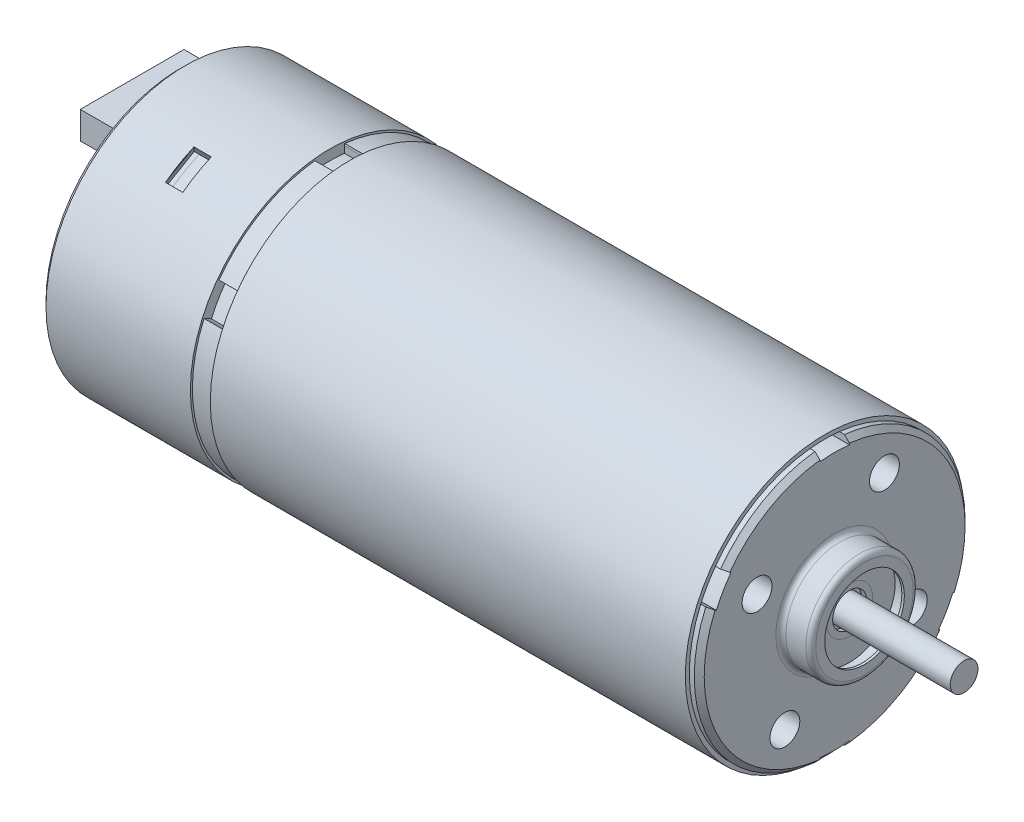
from build123d import *

# Parameters (mm, degrees)
SKETCH1_R               = 13.6
BOSS_EXTRUDE1_DEPTH     = 50.7
CUT_EXTRUDE1_DEPTH      = 55.225547485
SKETCH3_R               = 14
SKETCH3_R_2             = 13.6
BOSS_EXTRUDE2_DEPTH     = 47.7
SKETCH4_R               = 14
BOSS_EXTRUDE3_DEPTH     = 15
BOSS_EXTRUDE4_START     = 2
BOSS_EXTRUDE4_DEPTH     = 2
SKETCH6_R               = 1.5
CUT_EXTRUDE2_DEPTH      = 7
SKETCH7_R               = 5.4
BOSS_EXTRUDE5_DEPTH     = 3
SKETCH8_R               = 4
CUT_EXTRUDE3_DEPTH      = 1.5
SKETCH9_R               = 1.7
CUT_EXTRUDE4_DEPTH      = 0.5
CUT_EXTRUDE5_START      = 1.25
SKETCH12_R              = 4.570841128
SKETCH12_R_2            = 4
CUT_EXTRUDE5_DEPTH      = 1.25
FILLET1_R               = 0.5
CHAMFER1_SIZE           = 0.5
CUT_EXTRUDE6_REACH      = 75.756
CUT_EXTRUDE6_END_RADIUS = 12.956768024
SKETCH13_W              = 1.739955734
SKETCH13_H              = 3.306373614
CUT_EXTRUDE7_DEPTH      = 0.5
CUT_EXTRUDE8_DEPTH      = 3.306373613
BOSS_EXTRUDE7_DEPTH     = 3.306373613
SKETCH17_W              = 10.414574722
SKETCH17_H              = 2.75
BOSS_EXTRUDE8_DEPTH     = 4.85
SKETCH18_W              = 9.614574722
SKETCH18_H              = 1.95
CUT_EXTRUDE10_DEPTH     = 4.85
SKETCH20_R              = 0.7
BOSS_EXTRUDE9_DEPTH     = 4.85
SCALE1_SCALE            = 0.25
SKETCH21_R              = 0.348695204
BOSS_EXTRUDE10_DEPTH    = 3


with BuildPart() as part:
    # Sketch1 → Boss-Extrude1 (new body)
    with BuildSketch(Plane(origin=(0, 0, 0), x_dir=(0, 0, -1), z_dir=(1, 0, 0))):
        Circle(SKETCH1_R)
    extrude(amount=-BOSS_EXTRUDE1_DEPTH)

    # Sketch2 → Cut-Extrude1 (cut, through all)
    with BuildSketch(Plane(origin=(0, 0, 0), x_dir=(0, 0, -1), z_dir=(1, 0, 0))):
        with BuildLine():
            Line((-1.476652596, 12.872347678), (-1.476652596, 14.372812182))
            Line((-1.476652596, 14.372812182), (1.476652596, 14.372812182))
            Line((1.476652596, 14.372812182), (1.476652596, 12.872347678))
            ThreePointArc((1.476652596, 12.872347678), (0, 12.956768024), (-1.476652596, 12.872347678))
        make_face()
        with BuildLine():
            Line((1.476652596, -12.872347678), (1.476652596, -14.372812182))
            Line((1.476652596, -14.372812182), (-1.476652596, -14.372812182))
            Line((-1.476652596, -14.372812182), (-1.476652596, -12.872347678))
            ThreePointArc((-1.476652596, -12.872347678), (0, -12.956768024), (1.476652596, -12.872347678))
        make_face()
        with BuildLine():
            Line((11.886106393, -5.157355179), (13.185546772, -5.907587431))
            Line((13.185546772, -5.907587431), (11.708894176, -8.465224751))
            Line((11.708894176, -8.465224751), (10.409453797, -7.714992499))
            ThreePointArc((10.409453797, -7.714992499), (11.220890259, -6.478384012), (11.886106393, -5.157355179))
        make_face()
        with BuildLine():
            Line((-11.886106393, 5.157355179), (-13.185546772, 5.907587431))
            Line((-13.185546772, 5.907587431), (-11.708894176, 8.465224751))
            Line((-11.708894176, 8.465224751), (-10.409453797, 7.714992499))
            ThreePointArc((-10.409453797, 7.714992499), (-11.220890259, 6.478384012), (-11.886106393, 5.157355179))
        make_face()
    extrude(amount=-CUT_EXTRUDE1_DEPTH, mode=Mode.SUBTRACT)



with BuildPart() as body_2:
    # Sketch3 → Boss-Extrude2 (new body)
    with BuildSketch(Plane(origin=(-1, 0, 0), x_dir=(0, 0, -1), z_dir=(1, 0, 0))):
        Circle(SKETCH3_R)
        Circle(SKETCH3_R_2, mode=Mode.SUBTRACT)
    extrude(amount=-BOSS_EXTRUDE2_DEPTH)


with BuildPart() as body_3:
    # Sketch4 → Boss-Extrude3 (new body)
    with BuildSketch(Plane.ZY.offset(50.7)):
        Circle(SKETCH4_R)
    extrude(amount=BOSS_EXTRUDE3_DEPTH)


with BuildPart() as part_1:
    add(part.part)

    add(body_2.part)  # Boss-Extrude4 merges body 2

    add(body_3.part)  # Boss-Extrude4 merges body 3
    # Sketch5 → Boss-Extrude4 (add)
    with BuildSketch(Plane(origin=(-50.7, 0, 0), x_dir=(0, 0, -1), z_dir=(1, 0, 0)).offset(BOSS_EXTRUDE4_START)):
        with BuildLine():
            Line((1.476652596, 13.519596781), (1.498368075, 13.71841438))
            ThreePointArc((1.498368075, 13.71841438), (11.951150572, 6.9), (12.629679391, -5.561582373))
            Line((12.629679391, -5.561582373), (12.446640559, -5.48097973))
            ThreePointArc((12.446640559, -5.48097973), (11.777945491, 6.8), (1.476652596, 13.519596781))
        make_face()
        with BuildLine():
            Line((-1.476652596, 13.519596781), (-1.498368075, 13.71841438))
            ThreePointArc((-1.498368075, 13.71841438), (-6.9, 11.951150572), (-11.131311316, 8.156832007))
            Line((-11.131311316, 8.156832007), (-10.969987963, 8.038617051))
            ThreePointArc((-10.969987963, 8.038617051), (-6.8, 11.777945491), (-1.476652596, 13.519596781))
        make_face()
        with BuildLine():
            Line((10.969987963, -8.038617051), (11.131311316, -8.156832007))
            ThreePointArc((11.131311316, -8.156832007), (6.9, -11.951150572), (1.498368075, -13.71841438))
            Line((1.498368075, -13.71841438), (1.476652596, -13.519596781))
            ThreePointArc((1.476652596, -13.519596781), (6.8, -11.777945491), (10.969987963, -8.038617051))
        make_face()
        with BuildLine():
            Line((-1.476652596, -13.519596781), (-1.498368075, -13.71841438))
            ThreePointArc((-1.498368075, -13.71841438), (-11.951150572, -6.9), (-12.629679391, 5.561582373))
            Line((-12.629679391, 5.561582373), (-12.446640559, 5.48097973))
            ThreePointArc((-12.446640559, 5.48097973), (-11.777945491, -6.8), (-1.476652596, -13.519596781))
        make_face()
    extrude(amount=-BOSS_EXTRUDE4_DEPTH)

    # Sketch6 → Cut-Extrude2 (cut)
    with BuildSketch(Plane(origin=(0, 0, 0), x_dir=(0, 0, -1), z_dir=(1, 0, 0))):
        with Locations((-5, -8.660254038)):
            Circle(SKETCH6_R)
        with Locations((5, 8.660254038)):
            Circle(SKETCH6_R)
        with Locations((-7.794228634, 4.5)):
            Circle(SKETCH6_R)
        with Locations((7.794228634, -4.5)):
            Circle(SKETCH6_R)
    extrude(amount=-CUT_EXTRUDE2_DEPTH, mode=Mode.SUBTRACT)

    # Sketch7 → Boss-Extrude5 (add)
    with BuildSketch(Plane(origin=(0, 0, 0), x_dir=(0, 0, -1), z_dir=(1, 0, 0))):
        Circle(SKETCH7_R)
    extrude(amount=BOSS_EXTRUDE5_DEPTH)

    # Sketch8 → Cut-Extrude3 (cut)
    with BuildSketch(Plane(origin=(3, 0, 0), x_dir=(0, 0, -1), z_dir=(1, 0, 0))):
        Circle(SKETCH8_R)
    extrude(amount=-CUT_EXTRUDE3_DEPTH, mode=Mode.SUBTRACT)

    # Sketch9 → Cut-Extrude4 (cut)
    with BuildSketch(Plane(origin=(1.5, 0, 0), x_dir=(0, 0, -1), z_dir=(1, 0, 0))):
        Circle(SKETCH9_R)
    extrude(amount=-CUT_EXTRUDE4_DEPTH, mode=Mode.SUBTRACT)

    # Sketch12 → Cut-Extrude5 (cut)
    with BuildSketch(Plane(origin=(1.5, 0, 0), x_dir=(0, 0, -1), z_dir=(1, 0, 0)).offset(CUT_EXTRUDE5_START)):
        Circle(SKETCH12_R)
        Circle(SKETCH12_R_2, mode=Mode.SUBTRACT)
    extrude(amount=-CUT_EXTRUDE5_DEPTH, mode=Mode.SUBTRACT)

    # Fillet1
    fillet1_edges = [part_1.edges().sort_by_distance(p)[0] for p in [
        (0, 0, 5.4),
        (3, 0, 5.4),
    ]]
    fillet(fillet1_edges, radius=FILLET1_R)

    # Chamfer1
    chamfer1_edges = [part_1.edges().sort_by_distance(p)[0] for p in [
        (-65.7, 0, -14),
        (0, 11.777945491, 6.8),
        (0, -6.8, 11.777945491),
        (0, -11.777945491, -6.8),
        (0, 6.8, -11.777945491),
    ]]
    chamfer(chamfer1_edges, length=CHAMFER1_SIZE)

    # Cut-Extrude6: up to this cylinder (the profile starts outside it)
    cut_extrude6_end = Plane(origin=(-57.95, 0, 0), z_dir=(1, 0, 0)) * Cylinder(CUT_EXTRUDE6_END_RADIUS, 178.425536047, mode=Mode.PRIVATE)
    # Sketch13 → Cut-Extrude6 (cut, up to the surface)
    with BuildSketch(Plane(origin=(0, 12.124355653, 7), x_dir=(1, 0, 0), z_dir=(0, 0.866025403784438, 0.500000000000001)), mode=Mode.PRIVATE) as cut_extrude6_sk1:
        with Locations((-57.95, 0)):
            Rectangle(SKETCH13_W, SKETCH13_H)
    cut_extrude6_tool1 = extrude(cut_extrude6_sk1.sketch, amount=-CUT_EXTRUDE6_REACH, mode=Mode.PRIVATE) - cut_extrude6_end
    cut_extrude6 = cut_extrude6_tool1.solids().sort_by_distance((-57.95, 12.124356, 7))[0]
    add(cut_extrude6, mode=Mode.SUBTRACT)

    # Sketch14 → Cut-Extrude7 (cut)
    with BuildSketch(Plane(origin=(-58.819977867, 0, 0), x_dir=(0, 0, -1), z_dir=(1, 0, 0))):
        with BuildLine():
            Line((-5.256527567, 12.41094643), (-8.11993111, 10.757759624))
            Line((-8.11993111, 10.757759624), (-7.857135823, 10.302584835))
            ThreePointArc((-7.857135823, 10.302584835), (-6.478384012, 11.220890259), (-4.99373228, 11.955771641))
            Line((-4.99373228, 11.955771641), (-5.256527567, 12.41094643))
        make_face()
    cut_extrude7 = extrude(amount=-CUT_EXTRUDE7_DEPTH, mode=Mode.SUBTRACT)

    # Sketch15 → Cut-Extrude8 (cut)
    with BuildSketch(Plane(origin=(0, 0.826593403, -1.431701772), x_dir=(1, 0, 0), z_dir=(0, -0.5000000000000011, 0.8660254037844379))):
        Polygon((-58.819977867, 13.902049251), (-59.319977867, 12.850868103), (-58.819977867, 12.850868103), align=None)
    cut_extrude8 = extrude(amount=CUT_EXTRUDE8_DEPTH, mode=Mode.SUBTRACT)

    # Sketch16 → Boss-Extrude7 (add)
    with BuildSketch(Plane(origin=(0, 0.826593403, -1.431701772), x_dir=(1, 0, 0), z_dir=(0, -0.5000000000000011, 0.8660254037844379))):
        Polygon((-59.069977867, 13.376458677), (-59.319977867, 12.850868103), (-59.319977867, 13.376458677), align=None)
    boss_extrude7 = extrude(amount=BOSS_EXTRUDE7_DEPTH)

    # Mirror1: Cut-Extrude6, Cut-Extrude7, Cut-Extrude8, Boss-Extrude7 across plane
    add(cut_extrude6.mirror(Plane(origin=(0, 0, 0), x_dir=(0, -0.500000000000001, 0.866025403784438), z_dir=(0, 0.866025403784438, 0.500000000000001))), mode=Mode.SUBTRACT)
    add(cut_extrude7.mirror(Plane(origin=(0, 0, 0), x_dir=(0, -0.500000000000001, 0.866025403784438), z_dir=(0, 0.866025403784438, 0.500000000000001))), mode=Mode.SUBTRACT)
    add(cut_extrude8.mirror(Plane(origin=(0, 0, 0), x_dir=(0, -0.500000000000001, 0.866025403784438), z_dir=(0, 0.866025403784438, 0.500000000000001))), mode=Mode.SUBTRACT)
    add(boss_extrude7.mirror(Plane(origin=(0, 0, 0), x_dir=(0, -0.500000000000001, 0.866025403784438), z_dir=(0, 0.866025403784438, 0.500000000000001))))


with BuildPart() as body_2_2:
    # Sketch17 → Boss-Extrude8 (new body)
    with BuildSketch(Plane.ZY.offset(65.7)):
        with Locations((0, 8.736671017)):
            Rectangle(SKETCH17_W, SKETCH17_H)
    extrude(amount=BOSS_EXTRUDE8_DEPTH)

    # Sketch18 → Cut-Extrude10 (cut)
    with BuildSketch(Plane.ZY.offset(70.55)):
        with Locations((0, 8.736671017)):
            Rectangle(SKETCH18_W, SKETCH18_H)
    extrude(amount=-CUT_EXTRUDE10_DEPTH, mode=Mode.SUBTRACT)


    add(part_1.part)  # Boss-Extrude9 merges part
    # Sketch20 → Boss-Extrude9 (add)
    with BuildSketch(Plane.ZY.offset(65.7)):
        with Locations(Location((0, 8.736671017, 0), (0, 0, 180))):
            Circle(SKETCH20_R)
        with Locations(Location((1.8, 8.736671017, 0), (0, 0, 180))):
            Circle(SKETCH20_R)
        with Locations(Location((3.6, 8.736671017, 0), (0, 0, 180))):
            Circle(SKETCH20_R)
        with Locations(Location((-1.8, 8.736671017, 0), (0, 0, 180))):
            Circle(SKETCH20_R)
        with Locations(Location((-3.6, 8.736671017, 0), (0, 0, 180))):
            Circle(SKETCH20_R)
    extrude(amount=BOSS_EXTRUDE9_DEPTH)


with BuildPart() as body_2_2_1:
    # Scale1: scaled about (-32.994808114, 0.01862081, 0)
    add(body_2_2.part.scale(SCALE1_SCALE).moved(Location((-24.746106086, 0.013965608, 0))))

    # Sketch21 → Boss-Extrude10 (add)
    with BuildSketch(Plane(origin=(-24.496106086, 0, 0), x_dir=(0, 0, -1), z_dir=(1, 0, 0))):
        Circle(SKETCH21_R)
    extrude(amount=BOSS_EXTRUDE10_DEPTH)


solid = body_2_2_1.part
